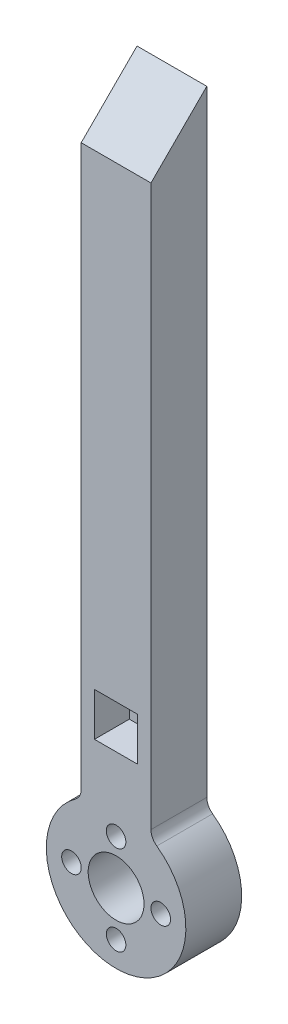
from build123d import *

# Parameters (mm, degrees)
SKETCH1_R           = 5.08
SKETCH1_R_2         = 1.778
BOSS_EXTRUDE1_DEPTH = 10.16
BOSS_EXTRUDE3_DEPTH = 12.7
SKETCH3_W           = 7.874
SKETCH3_H           = 7.874
CUT_EXTRUDE1_DEPTH  = 6.35
FILLET1_R           = 2.54


with BuildPart() as part:
    # Sketch1 → Boss-Extrude1 (new body)
    with BuildSketch(Plane.XY):
        with BuildLine():
            Line((-6.35, 12.7), (-6.35, 10.998522628))
            ThreePointArc((-6.35, 10.998522628), (0, -12.7), (6.35, 10.998522628))
            Line((6.35, 10.998522628), (6.35, 12.7))
            Line((6.35, 12.7), (6.35, 114.3))
            Line((6.35, 114.3), (-6.35, 114.3))
            Line((-6.35, 114.3), (-6.35, 12.7))
        make_face()
        Circle(SKETCH1_R, mode=Mode.SUBTRACT)
        with Locations((0, 8.128)):
            Circle(SKETCH1_R_2, mode=Mode.SUBTRACT)
        with Locations((8.128, 0)):
            Circle(SKETCH1_R_2, mode=Mode.SUBTRACT)
        with Locations((0, -8.128)):
            Circle(SKETCH1_R_2, mode=Mode.SUBTRACT)
        with Locations((-8.128, 0)):
            Circle(SKETCH1_R_2, mode=Mode.SUBTRACT)
    extrude(amount=BOSS_EXTRUDE1_DEPTH)

    # Sketch2 → Boss-Extrude3 (add)
    with BuildSketch(Plane.ZY.offset(-6.35)):
        Polygon((0, 124.46), (10.16, 114.3), (0, 114.3), align=None)
    extrude(amount=BOSS_EXTRUDE3_DEPTH)

    # Sketch3 → Cut-Extrude1 (cut)
    with BuildSketch(Plane.XY.offset(10.16)):
        with Locations((0, 25.4)):
            Rectangle(SKETCH3_W, SKETCH3_H)
    extrude(amount=-CUT_EXTRUDE1_DEPTH, mode=Mode.SUBTRACT)

    # Fillet1
    fillet1_edges = [part.edges().sort_by_distance(p)[0] for p in [
        (6.35, 10.998522628, 5.08),
        (-6.35, 10.998522628, 5.08),
    ]]
    fillet(fillet1_edges, radius=FILLET1_R)


solid = part.part
